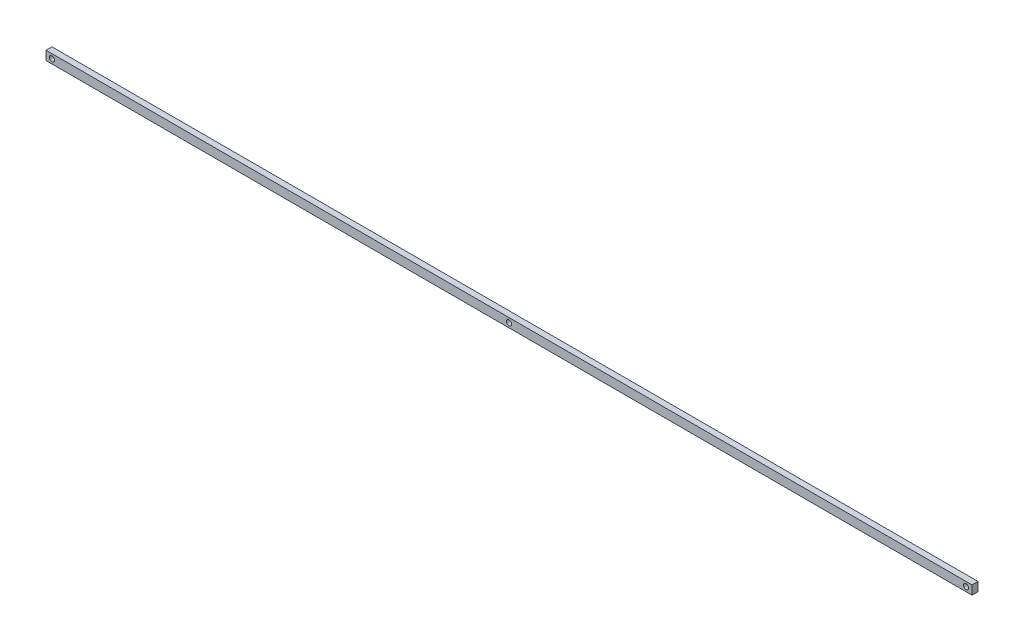
from build123d import *

# Parameters (mm, degrees)
SKETCH1_W           = 1556
SKETCH1_H           = 15
BOSS_EXTRUDE1_DEPTH = 10
SKETCH2_R           = 4.255
CUT_EXTRUDE1_DEPTH  = 10


with BuildPart() as part:
    # Sketch1 → Boss-Extrude1 (new body)
    with BuildSketch(Plane.XY):
        with Locations((778, 7.5)):
            Rectangle(SKETCH1_W, SKETCH1_H)
    extrude(amount=BOSS_EXTRUDE1_DEPTH)

    # Sketch2 → Cut-Extrude1 (cut)
    with BuildSketch(Plane.XY.offset(10)):
        with Locations((10, 7.5)):
            Circle(SKETCH2_R)
        with Locations((1546, 7.5)):
            Circle(SKETCH2_R)
        with Locations((778, 7.5)):
            Circle(SKETCH2_R)
    extrude(amount=-CUT_EXTRUDE1_DEPTH, mode=Mode.SUBTRACT)


solid = part.part
